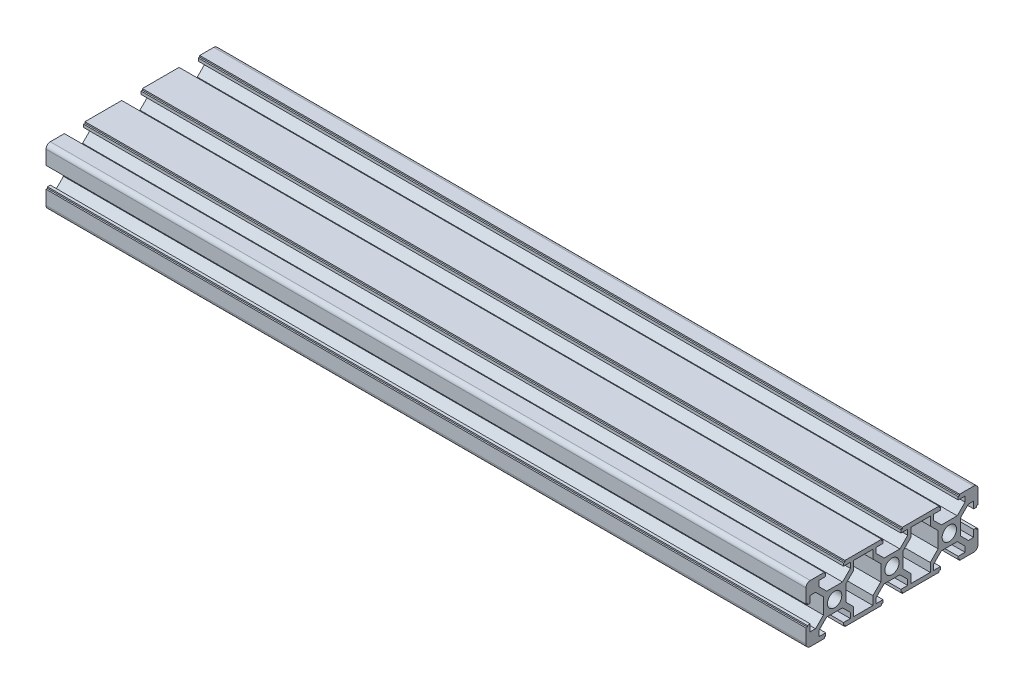
from build123d import *

# Parameters (mm, degrees)
SKETCH1_R                = 2.5
F_20_X_20_X_R1_5_1_DEPTH = 265


with BuildPart() as part:
    # Sketch1 → 铝型材 20 X 20 X R1.5(1) (new body)
    with BuildSketch(Plane(origin=(548.637296324, 8.985389246, 0), x_dir=(0, 1, 0), z_dir=(1, 0, 0))):
        with BuildLine():
            Line((-10, -3.6), (-9.5, -3.6))
            Line((-9.5, -3.6), (-9.5, -3.1))
            Line((-9.5, -3.1), (-8.5, -3.1))
            Line((-8.5, -3.1), (-8.5, -5.5))
            Line((-8.5, -5.5), (-6.65, -5.5))
            Line((-6.65, -5.5), (-3.9, -2.75))
            Line((-3.9, -2.75), (-3.9, 2.75))
            Line((-3.9, 2.75), (-6.65, 5.5))
            Line((-6.65, 5.5), (-8.5, 5.5))
            Line((-8.5, 5.5), (-8.5, 3.1))
            Line((-8.5, 3.1), (-9.5, 3.1))
            Line((-9.5, 3.1), (-9.5, 3.6))
            Line((-9.5, 3.6), (-10, 3.6))
            Line((-10, 3.6), (-10, 8.5))
            Line((-10, 8.5), (-10, 11.5))
            Line((-10, 11.5), (-10, 16.4))
            Line((-10, 16.4), (-9.5, 16.4))
            Line((-9.5, 16.4), (-9.5, 16.9))
            Line((-9.5, 16.9), (-8.5, 16.9))
            Line((-8.5, 16.9), (-8.5, 14.5))
            Line((-8.5, 14.5), (-6.65, 14.5))
            Line((-6.65, 14.5), (-3.9, 17.25))
            Line((-3.9, 17.25), (-3.9, 22.75))
            Line((-3.9, 22.75), (-6.65, 25.5))
            Line((-6.65, 25.5), (-8.5, 25.5))
            Line((-8.5, 25.5), (-8.5, 23.1))
            Line((-8.5, 23.1), (-9.5, 23.1))
            Line((-9.5, 23.1), (-9.5, 23.6))
            Line((-9.5, 23.6), (-10, 23.6))
            Line((-10, 23.6), (-10, 28.5))
            Line((-10, 28.5), (-10, 31.5))
            Line((-10, 31.5), (-10, 36.4))
            Line((-10, 36.4), (-9.5, 36.4))
            Line((-9.5, 36.4), (-9.5, 36.9))
            Line((-9.5, 36.9), (-8.5, 36.9))
            Line((-8.5, 36.9), (-8.5, 34.5))
            Line((-8.5, 34.5), (-6.65, 34.5))
            Line((-6.65, 34.5), (-3.9, 37.25))
            Line((-3.9, 37.25), (-3.9, 42.75))
            Line((-3.9, 42.75), (-6.65, 45.5))
            Line((-6.65, 45.5), (-8.5, 45.5))
            Line((-8.5, 45.5), (-8.5, 43.1))
            Line((-8.5, 43.1), (-9.5, 43.1))
            Line((-9.5, 43.1), (-9.5, 43.6))
            Line((-9.5, 43.6), (-10, 43.6))
            Line((-10, 43.6), (-10, 48.5))
            ThreePointArc((-10, 48.5), (-9.560660172, 49.560660172), (-8.5, 50))
            Line((-8.5, 50), (-3.6, 50))
            Line((-3.6, 50), (-3.6, 49.5))
            Line((-3.6, 49.5), (-3.1, 49.5))
            Line((-3.1, 49.5), (-3.1, 48.5))
            Line((-3.1, 48.5), (-5.5, 48.5))
            Line((-5.5, 48.5), (-5.5, 46.65))
            Line((-5.5, 46.65), (-2.75, 43.9))
            Line((-2.75, 43.9), (2.75, 43.9))
            Line((2.75, 43.9), (5.5, 46.65))
            Line((5.5, 46.65), (5.5, 48.5))
            Line((5.5, 48.5), (3.1, 48.5))
            Line((3.1, 48.5), (3.1, 49.5))
            Line((3.1, 49.5), (3.6, 49.5))
            Line((3.6, 49.5), (3.6, 50))
            Line((3.6, 50), (8.5, 50))
            ThreePointArc((8.5, 50), (9.560660172, 49.560660172), (10, 48.5))
            Line((10, 48.5), (10, 43.6))
            Line((10, 43.6), (9.5, 43.6))
            Line((9.5, 43.6), (9.5, 43.1))
            Line((9.5, 43.1), (8.5, 43.1))
            Line((8.5, 43.1), (8.5, 45.5))
            Line((8.5, 45.5), (6.65, 45.5))
            Line((6.65, 45.5), (3.9, 42.75))
            Line((3.9, 42.75), (3.9, 37.25))
            Line((3.9, 37.25), (6.65, 34.5))
            Line((6.65, 34.5), (8.5, 34.5))
            Line((8.5, 34.5), (8.5, 36.9))
            Line((8.5, 36.9), (9.5, 36.9))
            Line((9.5, 36.9), (9.5, 36.4))
            Line((9.5, 36.4), (10, 36.4))
            Line((10, 36.4), (10, 31.5))
            Line((10, 31.5), (10, 28.5))
            Line((10, 28.5), (10, 23.6))
            Line((10, 23.6), (9.5, 23.6))
            Line((9.5, 23.6), (9.5, 23.1))
            Line((9.5, 23.1), (8.5, 23.1))
            Line((8.5, 23.1), (8.5, 25.5))
            Line((8.5, 25.5), (6.65, 25.5))
            Line((6.65, 25.5), (3.9, 22.75))
            Line((3.9, 22.75), (3.9, 17.25))
            Line((3.9, 17.25), (6.65, 14.5))
            Line((6.65, 14.5), (8.5, 14.5))
            Line((8.5, 14.5), (8.5, 16.9))
            Line((8.5, 16.9), (9.5, 16.9))
            Line((9.5, 16.9), (9.5, 16.4))
            Line((9.5, 16.4), (10, 16.4))
            Line((10, 16.4), (10, 11.5))
            Line((10, 11.5), (10, 8.5))
            Line((10, 8.5), (10, 3.6))
            Line((10, 3.6), (9.5, 3.6))
            Line((9.5, 3.6), (9.5, 3.1))
            Line((9.5, 3.1), (8.5, 3.1))
            Line((8.5, 3.1), (8.5, 5.5))
            Line((8.5, 5.5), (6.65, 5.5))
            Line((6.65, 5.5), (3.9, 2.75))
            Line((3.9, 2.75), (3.9, -2.75))
            Line((3.9, -2.75), (6.65, -5.5))
            Line((6.65, -5.5), (8.5, -5.5))
            Line((8.5, -5.5), (8.5, -3.1))
            Line((8.5, -3.1), (9.5, -3.1))
            Line((9.5, -3.1), (9.5, -3.6))
            Line((9.5, -3.6), (10, -3.6))
            Line((10, -3.6), (10, -8.5))
            ThreePointArc((10, -8.5), (9.560660172, -9.560660172), (8.5, -10))
            Line((8.5, -10), (3.6, -10))
            Line((3.6, -10), (3.6, -9.5))
            Line((3.6, -9.5), (3.1, -9.5))
            Line((3.1, -9.5), (3.1, -8.5))
            Line((3.1, -8.5), (5.5, -8.5))
            Line((5.5, -8.5), (5.5, -6.65))
            Line((5.5, -6.65), (2.75, -3.9))
            Line((2.75, -3.9), (-2.75, -3.9))
            Line((-2.75, -3.9), (-5.5, -6.65))
            Line((-5.5, -6.65), (-5.5, -8.5))
            Line((-5.5, -8.5), (-3.1, -8.5))
            Line((-3.1, -8.5), (-3.1, -9.5))
            Line((-3.1, -9.5), (-3.6, -9.5))
            Line((-3.6, -9.5), (-3.6, -10))
            Line((-3.6, -10), (-8.5, -10))
            ThreePointArc((-8.5, -10), (-9.560660172, -9.560660172), (-10, -8.5))
            Line((-10, -8.5), (-10, -3.6))
        make_face()
        Circle(SKETCH1_R, mode=Mode.SUBTRACT)
        with Locations((0, 20)):
            Circle(SKETCH1_R, mode=Mode.SUBTRACT)
        with Locations((0, 40)):
            Circle(SKETCH1_R, mode=Mode.SUBTRACT)
        Polygon((-5.5, 6.65), (-8.5, 6.65), (-8.5, 13.35), (-5.5, 13.35), (-2.75, 16.1), (2.75, 16.1), (5.5, 13.35), (8.5, 13.35), (8.5, 6.65), (5.5, 6.65), (2.75, 3.9), (-2.75, 3.9), align=None, mode=Mode.SUBTRACT)
        Polygon((-5.5, 26.65), (-8.5, 26.65), (-8.5, 33.35), (-5.5, 33.35), (-2.75, 36.1), (2.75, 36.1), (5.5, 33.35), (8.5, 33.35), (8.5, 26.65), (5.5, 26.65), (2.75, 23.9), (-2.75, 23.9), align=None, mode=Mode.SUBTRACT)
    extrude(amount=F_20_X_20_X_R1_5_1_DEPTH)


solid = part.part
